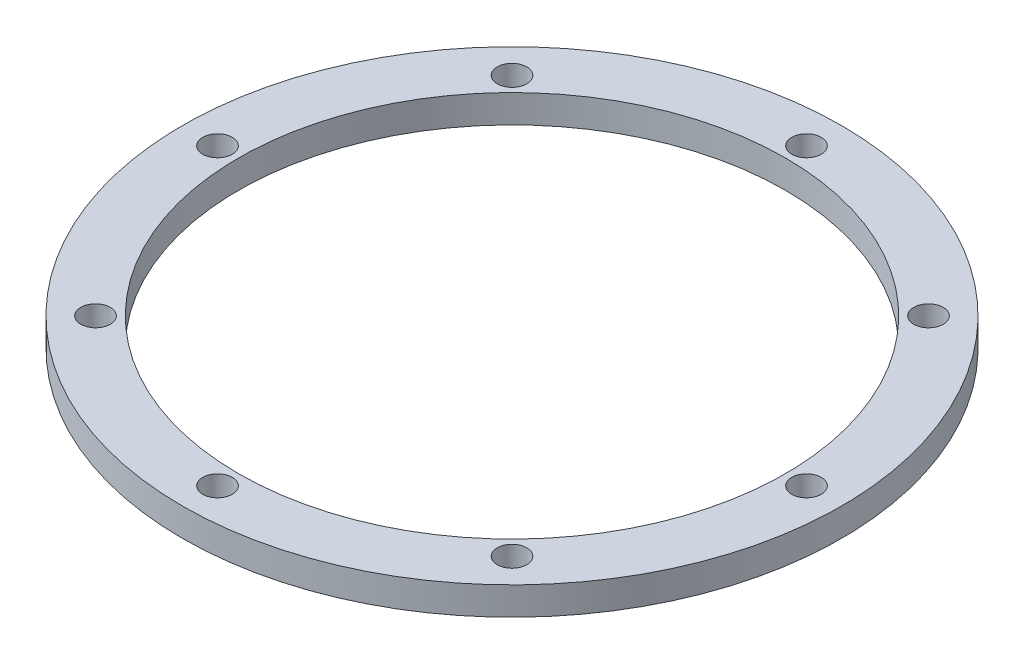
from build123d import *

# Parameters (mm, degrees)
SKETCH_1_W          = 8
SKETCH_1_H          = 4
SKETCH_2_R          = 2.1
CUT_EXTRUDE_1_DEPTH = 10


with BuildPart() as part:
    # 草图1 → 旋转1 (revolve)
    with BuildSketch(Plane.XY, mode=Mode.PRIVATE) as revolve_1_sk:
        with Locations((-43, 2)):
            Rectangle(SKETCH_1_W, SKETCH_1_H)
    revolve(revolve_1_sk.sketch.rotate(Axis((0, 0, 0), (0, 1, 0)), 270), axis=Axis((0, 0, 0), (0, 1, 0)))

    # 草图2 → 切除-拉伸1 (cut)
    with BuildSketch(Plane.XZ):
        with Locations(Location((0, 42, 0), (0, 0, 270))):
            Circle(SKETCH_2_R)
        with Locations(Location((29.69848481, 29.69848481, 0), (0, 0, 270))):
            Circle(SKETCH_2_R)
        with Locations(Location((42, 0, 0), (0, 0, 270))):
            Circle(SKETCH_2_R)
        with Locations(Location((29.69848481, -29.69848481, 0), (0, 0, 270))):
            Circle(SKETCH_2_R)
        with Locations(Location((0, -42, 0), (0, 0, 270))):
            Circle(SKETCH_2_R)
        with Locations(Location((-29.69848481, -29.69848481, 0), (0, 0, 270))):
            Circle(SKETCH_2_R)
        with Locations(Location((-42, 0, 0), (0, 0, 270))):
            Circle(SKETCH_2_R)
        with Locations(Location((-29.69848481, 29.69848481, 0), (0, 0, 270))):
            Circle(SKETCH_2_R)
    extrude(amount=-CUT_EXTRUDE_1_DEPTH, mode=Mode.SUBTRACT)


solid = part.part
